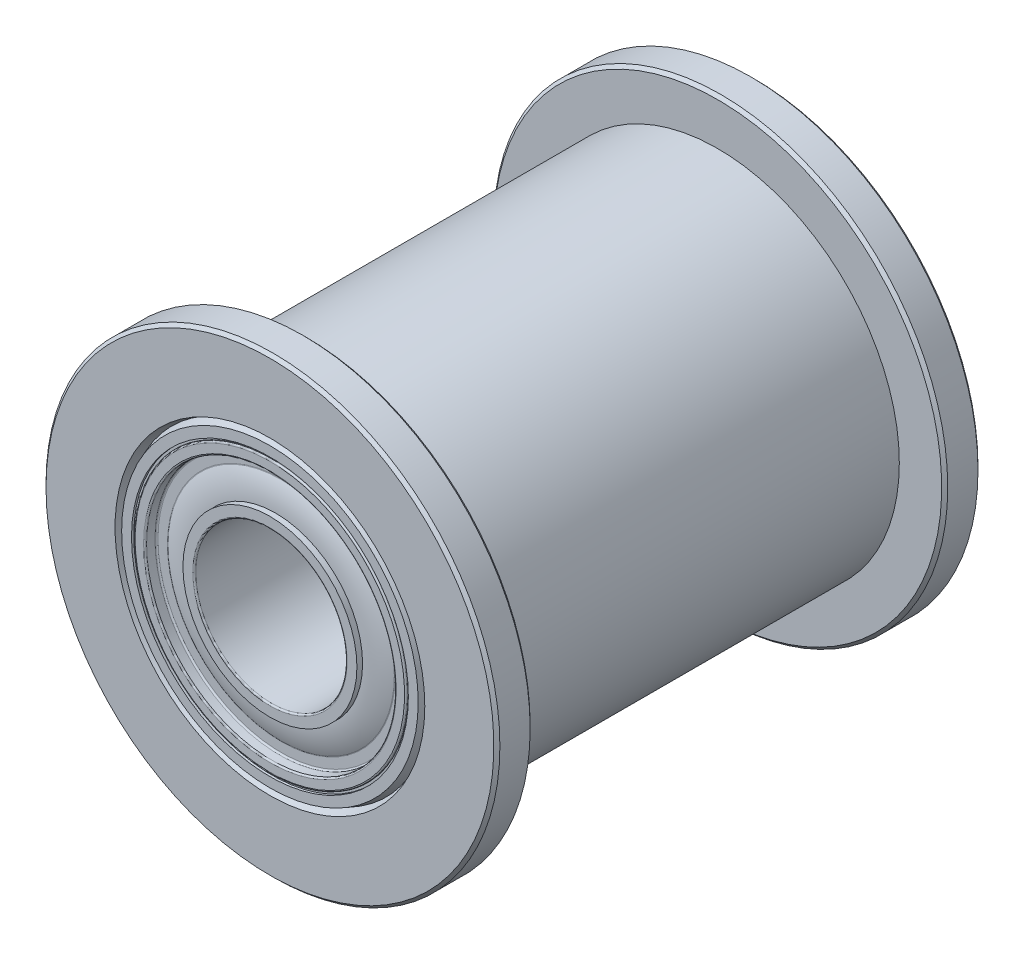
from build123d import *

# Parameters (mm, degrees)
CHAMFER1_SIZE = 0.1
FILLET2_R     = 0.05


with BuildPart() as part:
    # Sketch2 → Revolve1 (revolve)
    with BuildSketch(Plane(origin=(0, 0, 0), x_dir=(0, 0, -1), z_dir=(1, 0, 0))):
        with BuildLine():
            Line((8, 2.5), (0, 2.5))
            Line((0, 2.5), (0, 4.5))
            Line((0, 4.5), (8, 4.5))
            Line((8, 4.5), (8, 4.125))
            Line((8, 4.125), (7.625, 4.125))
            Line((7.625, 4.125), (7.625, 3.75))
            ThreePointArc((7.625, 3.75), (7.765098905, 3.322431908), (7.8125, 2.875))
            Line((7.8125, 2.875), (8, 2.875))
            Line((8, 2.875), (8, 2.5))
        make_face()
    revolve(axis=Axis((0, 0, 8), (0, 0, -1)))

    # Mirror1: part across plane


with BuildPart() as part_1:
    add(part.part)
    add(part.part.mirror(Plane.XY))

    # Fillet2
    fillet2_edges = [part_1.edges().sort_by_distance(p)[0] for p in [
        (0, -3.75, 7.625),
        (0, -4.125, 7.625),
        (0, -4.5, 8),
        (0, -4.125, 8),
        (0, -2.5, 8),
        (0, -2.5, -8),
        (0, -4.5, -8),
        (0, -3.75, -7.625),
        (0, -4.125, -8),
        (0, -2.875, -8),
    ]]
    fillet(fillet2_edges, radius=FILLET2_R)


with BuildPart() as body_2:
    # Sketch3 → Revolve2 (revolve)
    with BuildSketch(Plane(origin=(0, 0, 0), x_dir=(0, 0, -1), z_dir=(1, 0, 0))):
        Polygon((6.8, 7.5), (8, 7.5), (8, 5.118382141), (7.7, 5.00919107), (8, 4.9), (8, 4.575), (7.925, 4.575), (7.925, 4.5), (-7.925, 4.5), (-7.925, 4.575), (-8, 4.575), (-8, 4.9), (-7.7, 5.00919107), (-8, 5.118382141), (-8, 7.5), (-6.8, 7.5), (-6.8, 6), (6.8, 6), align=None)
    revolve(axis=Axis((0, 0, 8), (0, 0, -1)))

    # Chamfer1
    chamfer1_edges = [body_2.edges().sort_by_distance(p)[0] for p in [
        (0, -7.5, -8),
        (0, -7.5, -6.8),
        (0, -7.5, 6.8),
        (0, -7.5, 8),
    ]]
    chamfer(chamfer1_edges, length=CHAMFER1_SIZE)

    # Combine1: union part
    add(part_1.part)


solid = body_2.part
